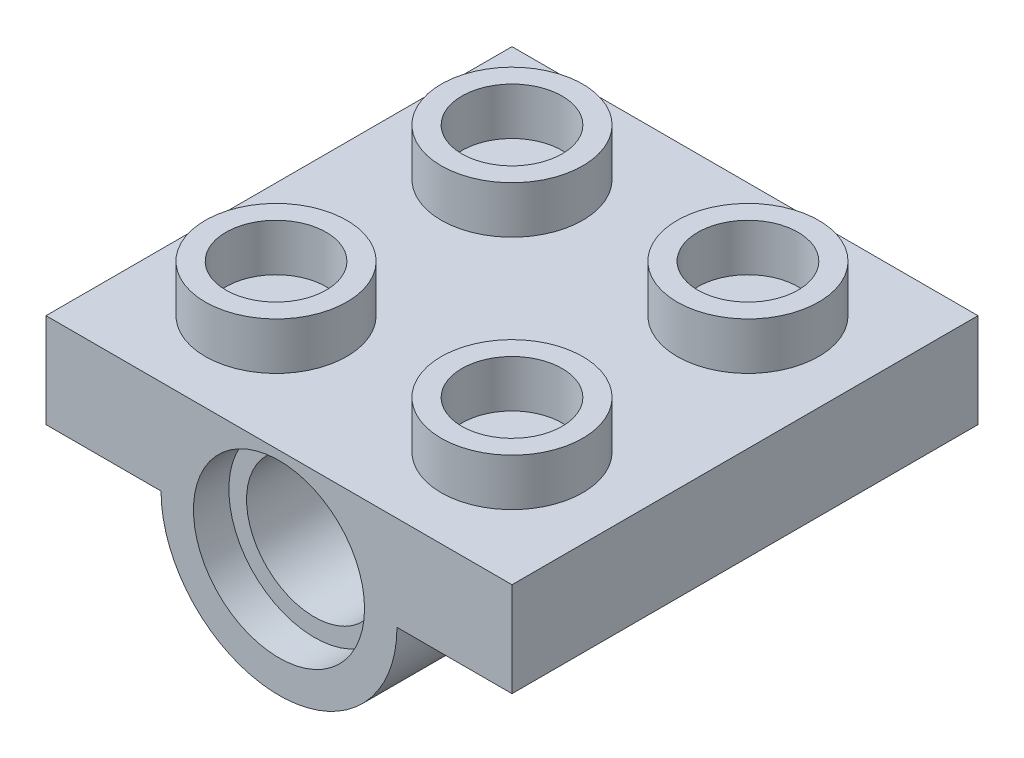
from build123d import *

# Parameters (mm, degrees)
SKETCH1_W            = 15.8
SKETCH1_H            = 3.2
BOSS_EXTRUDE1_DEPTH  = 15.8
SKETCH2_R            = 2.4
BOSS_EXTRUDE2_DEPTH  = 1.6
SKETCH10_R           = 1.7
CUT_EXTRUDE8_DEPTH   = 1.6
LPATTERN1_COUNT      = 2
LPATTERN1_PITCH      = 8
LPATTERN1_COUNT_DIR2 = 2
LPATTERN1_PITCH_DIR2 = 8
SKETCH3_W            = 13.4
SKETCH3_H            = 13.4
CUT_EXTRUDE1_DEPTH   = 3
BOSS_EXTRUDE3_DEPTH  = 6.9
SKETCH8_R            = 2.9
CUT_EXTRUDE6_DEPTH   = 1.2
CUT_EXTRUDE7_START   = -5.7
SKETCH9_R            = 2.3
CUT_EXTRUDE7_DEPTH   = 28.741778513


with BuildPart() as part:
    # Sketch1 → Boss-Extrude1 (new body)
    with BuildSketch(Plane.XY):
        with Locations((7.9, 1.6)):
            Rectangle(SKETCH1_W, SKETCH1_H)
    extrude(amount=-BOSS_EXTRUDE1_DEPTH)

    # Sketch2 → Boss-Extrude2 (add)
    with BuildSketch(Plane(origin=(0, 3.2, 0), x_dir=(1, 0, 0), z_dir=(0, 1, 0))):
        with Locations(Location((3.9, 3.9, 0), (0, 0, 270))):
            Circle(SKETCH2_R)
    boss_extrude2 = extrude(amount=BOSS_EXTRUDE2_DEPTH)

    # Sketch10 → Cut-Extrude8 (cut)
    with BuildSketch(Plane(origin=(0, 4.8, 0), x_dir=(1, 0, 0), z_dir=(0, 1, 0))):
        with Locations(Location((3.9, 3.9, 0), (0, 0, 270))):
            Circle(SKETCH10_R)
    cut_extrude8 = extrude(amount=-CUT_EXTRUDE8_DEPTH, mode=Mode.SUBTRACT)

    # LPattern1: Boss-Extrude2, Cut-Extrude8 2 × 2
    with Locations(*[(j * LPATTERN1_PITCH_DIR2, 0, -i * LPATTERN1_PITCH) for i in range(LPATTERN1_COUNT) for j in range(LPATTERN1_COUNT_DIR2) if (i, j) != (0, 0)]):
        add(boss_extrude2)
        add(cut_extrude8, mode=Mode.SUBTRACT)

    # Sketch3 → Cut-Extrude1 (cut)
    with BuildSketch(Plane.XZ):
        with Locations((7.9, -7.9)):
            Rectangle(SKETCH3_W, SKETCH3_H)
    extrude(amount=-CUT_EXTRUDE1_DEPTH, mode=Mode.SUBTRACT)

    # Sketch4 → Boss-Extrude3 (add)
    with BuildSketch(Plane.XY):
        with BuildLine():
            Line((11.9, 0), (11.9, 3.2))
            Line((11.9, 3.2), (3.9, 3.2))
            Line((3.9, 3.2), (3.9, 0))
            ThreePointArc((3.9, 0), (7.9, -4), (11.9, 0))
        make_face()
    boss_extrude3 = extrude(amount=-BOSS_EXTRUDE3_DEPTH)

    # Sketch8 → Cut-Extrude6 (cut)
    with BuildSketch(Plane.XY):
        with Locations((7.9, 0)):
            Circle(SKETCH8_R)
    cut_extrude6 = extrude(amount=-CUT_EXTRUDE6_DEPTH, mode=Mode.SUBTRACT)

    # Sketch9 → Cut-Extrude7 (cut)
    with BuildSketch(Plane.XY.offset(-1.2).offset(CUT_EXTRUDE7_START)):
        with Locations((7.9, 0)):
            Circle(SKETCH9_R)
    cut_extrude7 = extrude(amount=CUT_EXTRUDE7_DEPTH, mode=Mode.SUBTRACT)

    # Mirror1: Boss-Extrude3, Cut-Extrude6, Cut-Extrude7 across plane
    add(boss_extrude3.mirror(Plane.XY.offset(-7.9)))
    add(cut_extrude6.mirror(Plane.XY.offset(-7.9)), mode=Mode.SUBTRACT)
    add(cut_extrude7.mirror(Plane.XY.offset(-7.9)), mode=Mode.SUBTRACT)


solid = part.part
